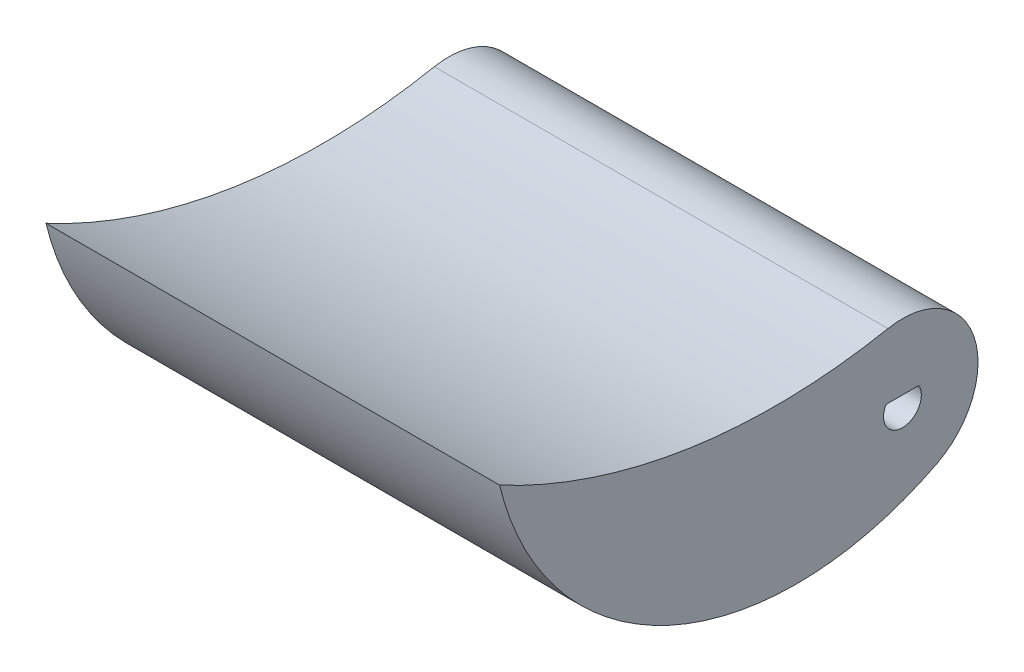
from build123d import *

# Parameters (mm, degrees)
BOSS_EXTRUDE1_DEPTH = 76.2


with BuildPart() as part:
    # Sketch1 → Boss-Extrude1 (new, symmetric)
    with BuildSketch(Plane(origin=(0, 0, 0), x_dir=(0, 0, -1), z_dir=(1, 0, 0))):
        with BuildLine():
            ThreePointArc((-4.852064404, 24.93225764), (23.991364551, 8.341128638), (11.661357948, -22.5648561))
            ThreePointArc((11.661357948, -22.5648561), (-78.193446496, -24.733850104), (-135.351657349, 44.631338202))
            ThreePointArc((-135.351657349, 44.631338202), (-71.80288322, 23.513113441), (-4.852064404, 24.93225764))
        make_face()
        with BuildLine():
            Line((-5.4991, 3.175279388), (5.4991, 3.175279388))
            ThreePointArc((5.4991, 3.175279388), (0, -6.35), (-5.4991, 3.175279388))
        make_face(mode=Mode.SUBTRACT)
    extrude(amount=BOSS_EXTRUDE1_DEPTH, both=True)


solid = part.part
